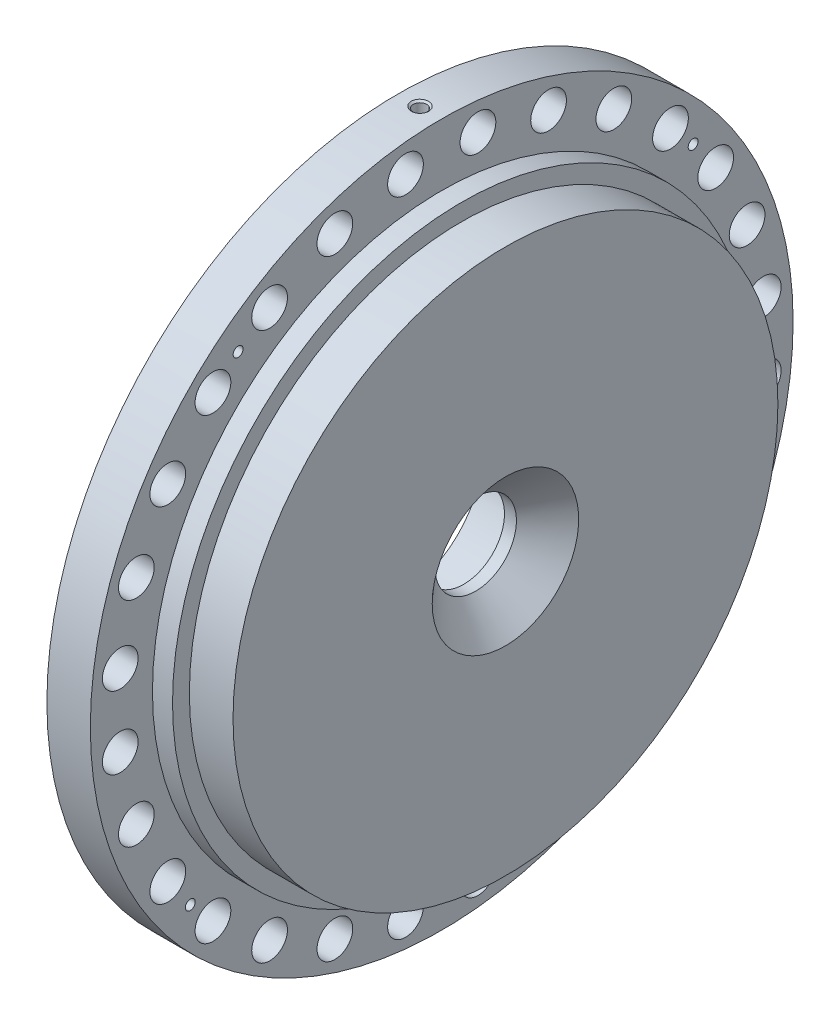
from build123d import *

# Parameters (mm, degrees)
SKETCH4_R                         = 14.2875
CUT_EXTRUDE1_DEPTH                = 407.60558878
CIRPATTERN2_COUNT                 = 28
CIRPATTERN3_COUNT                 = 12
CIRPATTERN4_COUNT                 = 4
CIRPATTERN5_COUNT                 = 4
F_1_2_13_TAPPED_HOLE4_D           = 10.71626
F_1_2_13_TAPPED_HOLE4_DEPTH       = 35.052
F_1_2_13_TAPPED_HOLE4_CSINK_D     = 13.97
F_1_2_13_TAPPED_HOLE4_CSINK_ANGLE = 100
F_1_2_13_TAPPED_HOLE4_TIP         = 3.219489309


with BuildPart() as part:
    # Sketch1 → Revolve1 (revolve)
    with BuildSketch(Plane.XY, mode=Mode.PRIVATE) as revolve1_sk:
        Polygon((-5.9944, 67.7545), (-5.9944, 180.9496), (0, 180.9496), (0, 228.9937), (-5.9944, 228.9937), (-5.9944, 281.051), (28.7528, 281.051), (28.7528, 231.3686), (44.8056, 231.3686), (44.8056, 217.9066), (79.7306, 217.9066), (79.7306, 58.5851), (55.9308, 32.5628), (46.4058, 32.5628), (46.4058, 67.7545), align=None)
    revolve(revolve1_sk.sketch.rotate(Axis((0, 0, 0), (1, 0, 0)), 90), axis=Axis((0, 0, 0), (1, 0, 0)))

    # Sketch4 → Cut-Extrude1 (cut, through all)
    with BuildSketch(Plane.ZY.offset(5.9944)):
        with Locations((28.972111579, 257.135466548)):
            Circle(SKETCH4_R)
    cut_extrude1 = extrude(amount=-CUT_EXTRUDE1_DEPTH, mode=Mode.SUBTRACT)

    # CirPattern2: Cut-Extrude1 ×28 about axis
    cirpattern2_axis = Axis((0, 0, 0), (1, 0, 0))
    for i in range(1, CIRPATTERN2_COUNT):
        add(cut_extrude1.rotate(cirpattern2_axis, i * 360 / CIRPATTERN2_COUNT), mode=Mode.SUBTRACT)

    # Sketch8 → 3/4-10 Tapped Hole1 (revolve, cut)
    with BuildSketch(Plane(origin=(0, 199.3429424, 53.413780433), x_dir=(0, 0, 1), z_dir=(0, 1, 0))):
        Polygon((0, 0), (0, 30.407416175), (8.33374, 25.4), (8.33374, 1.82626), (10.16, 0), align=None)
    f_3_4_10_tapped_hole1 = revolve(axis=Axis((-6.35, 199.3429424, 53.413780433), (1, 0, 0)), mode=Mode.SUBTRACT)

    # CirPattern3: 3/4-10 Tapped Hole1 ×12 about axis
    cirpattern3_axis = Axis((0, 0, 0), (1, 0, 0))
    for i in range(1, CIRPATTERN3_COUNT):
        add(f_3_4_10_tapped_hole1.rotate(cirpattern3_axis, i * 360 / CIRPATTERN3_COUNT), mode=Mode.SUBTRACT)

    # Sketch10 → 7/8-9 Tapped Hole1 (revolve, cut)
    with BuildSketch(Plane(origin=(-5.9944, 67.172315786, 67.172315786), x_dir=(0, 0, 1), z_dir=(0, 1, 0))):
        Polygon((0, 0), (0, 31.242239902), (9.72312, 25.4), (9.72312, 2.02438), (11.7475, 0), align=None)
    f_7_8_9_tapped_hole1 = revolve(axis=Axis((-12.3444, 67.172315786, 67.172315786), (1, 0, 0)), mode=Mode.SUBTRACT)

    # CirPattern4: 7/8-9 Tapped Hole1 ×4 about axis
    cirpattern4_axis = Axis((0, 0, 0), (1, 0, 0))
    for i in range(1, CIRPATTERN4_COUNT):
        add(f_7_8_9_tapped_hole1.rotate(cirpattern4_axis, i * 360 / CIRPATTERN4_COUNT), mode=Mode.SUBTRACT)

    # Sketch12 → Tap Drill for 3/8-16 Tap1 (revolve, cut)
    with BuildSketch(Plane(origin=(-5.9944, -162.844517689, 201.096231852), x_dir=(0, 0, 1), z_dir=(0, 1, 0))):
        Polygon((0, 0), (0, 43.024665582), (3.96875, 40.64), (3.96875, 0.635), (4.60375, 0), align=None)
    tap_drill_for_3_8_16_tap1 = revolve(axis=Axis((-12.3444, -162.844517689, 201.096231852), (1, 0, 0)), mode=Mode.SUBTRACT)

    # CirPattern5: Tap Drill for 3/8-16 Tap1 ×4 about axis
    cirpattern5_axis = Axis((0, 0, 0), (1, 0, 0))
    for i in range(1, CIRPATTERN5_COUNT):
        add(tap_drill_for_3_8_16_tap1.rotate(cirpattern5_axis, i * 360 / CIRPATTERN5_COUNT), mode=Mode.SUBTRACT)

    # 1/2-13 Tapped Hole4
    with Locations(Plane(origin=(11.3792, 281.051, 0), x_dir=(0, 0, 1), z_dir=(0, 1, 0))):
        with Locations((0, 0)):
            CounterSinkHole(F_1_2_13_TAPPED_HOLE4_D / 2, F_1_2_13_TAPPED_HOLE4_CSINK_D / 2, depth=F_1_2_13_TAPPED_HOLE4_DEPTH, counter_sink_angle=F_1_2_13_TAPPED_HOLE4_CSINK_ANGLE)
            with Locations((0, 0, -(F_1_2_13_TAPPED_HOLE4_DEPTH + F_1_2_13_TAPPED_HOLE4_TIP / 2))):  # 118° drill point
                Cone(0, F_1_2_13_TAPPED_HOLE4_D / 2, F_1_2_13_TAPPED_HOLE4_TIP, mode=Mode.SUBTRACT)


solid = part.part
